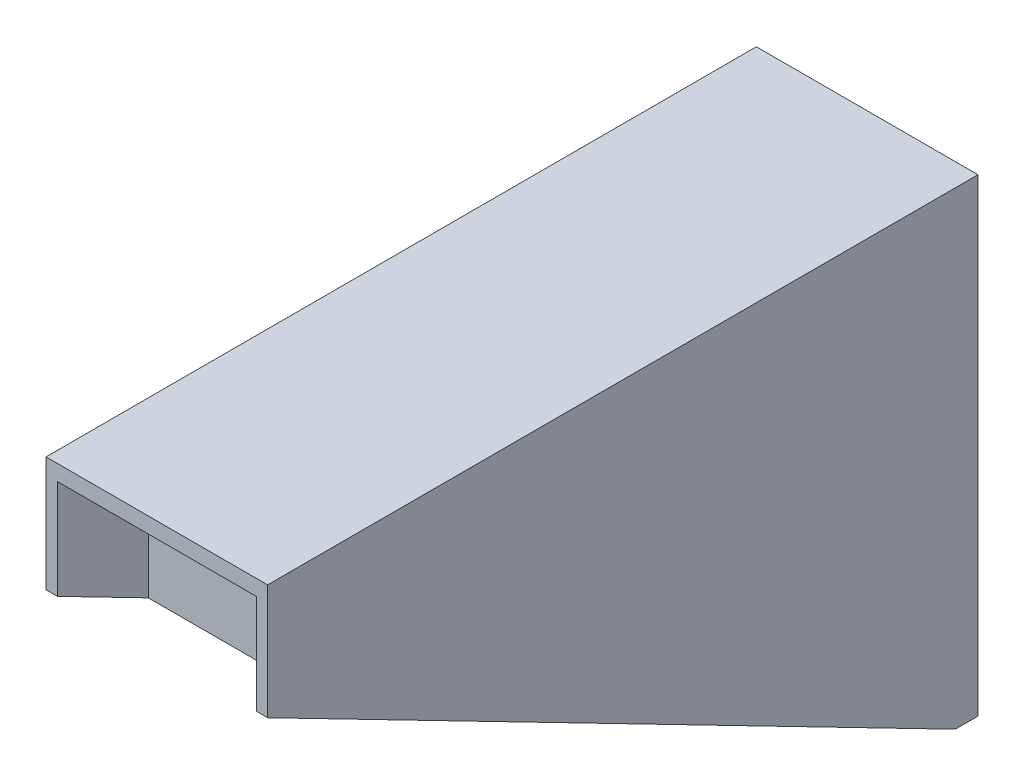
from build123d import *

# Parameters (mm, degrees)
ESQUISSE1_W                  = 78
ESQUISSE1_H                  = 165
BOSS_EXTRU_2_DEPTH           = 250
ENL_V_MAT_EXTRU_6_DEPTH      = 359.895122211
ENL_V_MAT_EXTRU_6_DEPTH_BACK = 32
ENL_V_MAT_EXTRU_7_DEPTH      = 332.582217321
ENL_V_MAT_EXTRU_7_DEPTH_BACK = 78


with BuildPart() as part:
    # Esquisse1 → Boss.-Extru.2 (new body)
    with BuildSketch(Plane.XY):
        with Locations((-118.933346394, -120.878383423)):
            Rectangle(ESQUISSE1_W, ESQUISSE1_H)
    extrude(amount=BOSS_EXTRU_2_DEPTH)

    # Esquisse3 → Enlèv. mat.-Extru.6 (cut, two sides: drawn at the far end of the back side and taken through both)
    with BuildSketch(Plane.XY.offset(250).offset(-ENL_V_MAT_EXTRU_6_DEPTH_BACK)):
        Polygon((-83.933346394, -575.046739794), (-83.933346394, -203.378383423), (-83.933346394, -43.878383423), (-153.933346394, -43.878383423), (-153.933346394, -203.378383423), (-153.933346394, -575.046739794), (-153.933346394, -1318.383452535), (-83.933346394, -1318.383452535), align=None)
    extrude(amount=ENL_V_MAT_EXTRU_6_DEPTH + ENL_V_MAT_EXTRU_6_DEPTH_BACK, mode=Mode.SUBTRACT)

    # Esquisse5 → Enlèv. mat.-Extru.7 (cut, two sides: drawn at the far end of the back side and taken through both)
    with BuildSketch(Plane(origin=(-79.933346394, 0, 0), x_dir=(0, 0, -1), z_dir=(1, 0, 0)).offset(-ENL_V_MAT_EXTRU_7_DEPTH_BACK)):
        Polygon((-779.795226733, 193.681557603), (-250, -78.878383423), (-8, -203.378383423), (521.795226733, -475.938324449), (-23.324655319, -1535.528777915), (-1324.915108785, -865.908895863), align=None)
    extrude(amount=ENL_V_MAT_EXTRU_7_DEPTH + ENL_V_MAT_EXTRU_7_DEPTH_BACK, mode=Mode.SUBTRACT)


solid = part.part
